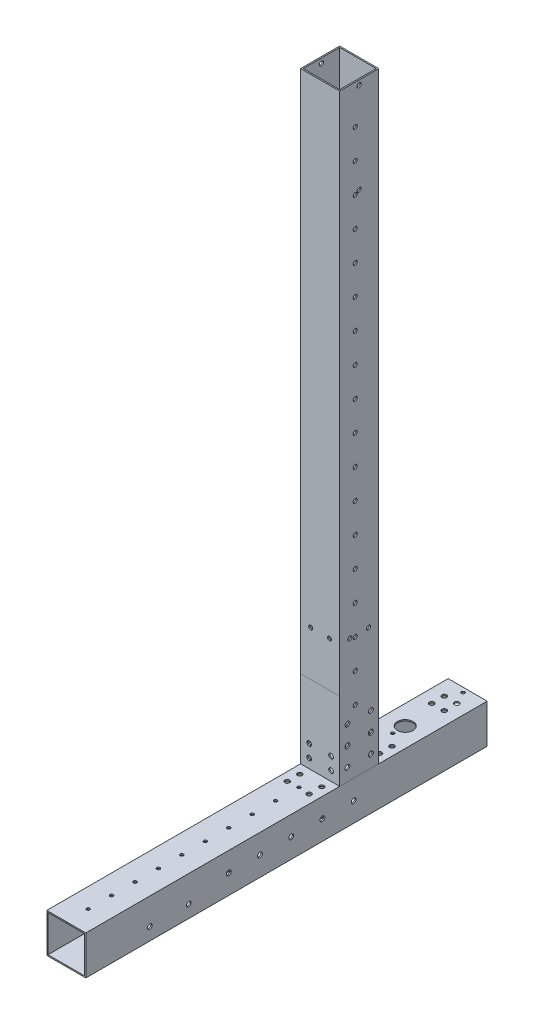
from build123d import *

# Parameters (mm, degrees)
F_20X20X1_1_DEPTH          = 398
F_20X20X1_1_DEPTH_BACK     = 1
SKETCH_11_W                = 25
SKETCH_11_H                = 25
SKETCH_11_W_2              = 23.4
SKETCH_11_H_2              = 23.4
SKETCH_11_ON_SEGMENT_2_W   = 25
SKETCH_11_ON_SEGMENT_2_H   = 25
SKETCH_11_ON_SEGMENT_2_W_2 = 23.4
SKETCH_11_ON_SEGMENT_2_H_2 = 23.4
F_20X20X1_1_2_DEPTH        = 257
SKETCH_18_R                = 1.05
SKETCH_18_R_2              = 1.55
SKETCH_18_R_3              = 5
CUT_EXTRUDE_7_DEPTH        = 447.420765646
SKETCH_20_R                = 1.5
CUT_EXTRUDE_9_DEPTH        = 436.492824281
SKETCH_25_W                = 25
SKETCH_25_H                = 50
CUT_EXTRUDE_13_DEPTH       = 0.01
SKETCH_26_R                = 1.3
CUT_EXTRUDE_14_DEPTH       = 436.492824281
SKETCH_27_R                = 1.3
CUT_EXTRUDE_15_DEPTH       = 441.132366454
SKETCH_28_R                = 1.55
SKETCH_28_R_2              = 1.3
SKETCH_28_R_3              = 1.35
CUT_EXTRUDE_16_DEPTH       = 436.492824281
SKETCH_29_R                = 1.5
CUT_EXTRUDE_17_DEPTH       = 424.546337489
SKETCH_30_R                = 1.5
CUT_EXTRUDE_18_DEPTH       = 431.07731863


with BuildPart() as part:
    # 草图11 → 方形管 20X20X1(1) (new, two sides: drawn at the far end of the back side and taken through both)
    with BuildSketch(Plane(origin=(0, 0, 0), x_dir=(1, 0, 0), z_dir=(0, 1, 0)).offset(-F_20X20X1_1_DEPTH_BACK)):
        Rectangle(SKETCH_11_W, SKETCH_11_H)
        Rectangle(SKETCH_11_W_2, SKETCH_11_H_2, mode=Mode.SUBTRACT)
    extrude(amount=F_20X20X1_1_DEPTH + F_20X20X1_1_DEPTH_BACK)

    # 方形管 20X20X1(1) end butt 1
    split(bisect_by=Plane(origin=(0, 12.5, 0), x_dir=(-1, 0, 0), z_dir=(0, 1, 0)), keep=Keep.TOP)

    # 草图25 → 切除-拉伸13 (cut)
    with BuildSketch(Plane.XY.offset(12.5)):
        with Locations((0, 37.5)):
            Rectangle(SKETCH_25_W, SKETCH_25_H)
    extrude(amount=-CUT_EXTRUDE_13_DEPTH, mode=Mode.SUBTRACT)

    # 草图26 → 切除-拉伸14 (cut, through all)
    with BuildSketch(Plane.ZY.offset(12.5)):
        with Locations((-6, 91.25)):
            Circle(SKETCH_26_R)
        with Locations((6, 91.25)):
            Circle(SKETCH_26_R)
    extrude(amount=-CUT_EXTRUDE_14_DEPTH, mode=Mode.SUBTRACT)

    # 草图27 → 切除-拉伸15 (cut, through all)
    with BuildSketch(Plane(origin=(0, 0, -12.5), x_dir=(-1, 0, 0), z_dir=(0, 0, -1))):
        with Locations((-6, 91.25)):
            Circle(SKETCH_27_R)
        with Locations((6, 91.25)):
            Circle(SKETCH_27_R)
    extrude(amount=-CUT_EXTRUDE_15_DEPTH, mode=Mode.SUBTRACT)


with BuildPart() as body_2:
    # 草图11 on segment 2 (carried to segment 2) → 20X20X1_1 2 (new body)
    with BuildSketch(Plane.XY.offset(-82)):
        Rectangle(SKETCH_11_ON_SEGMENT_2_W, SKETCH_11_ON_SEGMENT_2_H)
        Rectangle(SKETCH_11_ON_SEGMENT_2_W_2, SKETCH_11_ON_SEGMENT_2_H_2, mode=Mode.SUBTRACT)
    extrude(amount=F_20X20X1_1_2_DEPTH)

    # 草图18 → 切除-拉伸7 (cut, through all)
    with BuildSketch(Plane.XZ.offset(12.5)):
        with Locations((0, 236)):
            Circle(SKETCH_18_R)
        with Locations((0, 221)):
            Circle(SKETCH_18_R)
        with Locations((0, 206)):
            Circle(SKETCH_18_R)
        with Locations((0, 191)):
            Circle(SKETCH_18_R)
        with Locations((0, 176)):
            Circle(SKETCH_18_R)
        with Locations(Location((0, 161, 0), (0, 0, 270))):
            Circle(SKETCH_18_R)
        with Locations(Location((0, 146, 0), (0, 0, 270))):
            Circle(SKETCH_18_R)
        with Locations(Location((0, 131, 0), (0, 0, 270))):
            Circle(SKETCH_18_R)
        with Locations(Location((0, 116, 0), (0, 0, 270))):
            Circle(SKETCH_18_R)
        with Locations(Location((0, 101, 0), (0, 0, 270))):
            Circle(SKETCH_18_R)
        with Locations(Location((0, 86, 0), (0, 0, 270))):
            Circle(SKETCH_18_R)
        with Locations(Location((0, 71, 0), (0, 0, 270))):
            Circle(SKETCH_18_R)
        with Locations(Location((0, 56, 0), (0, 0, 270))):
            Circle(SKETCH_18_R)
        with Locations(Location((0, 41, 0), (0, 0, 270))):
            Circle(SKETCH_18_R)
        with Locations(Location((0, 26, 0), (0, 0, 270))):
            Circle(SKETCH_18_R)
        with Locations(Location((0, 11, 0), (0, 0, 270))):
            Circle(SKETCH_18_R)
        with Locations(Location((0, -4, 0), (0, 0, 270))):
            Circle(SKETCH_18_R)
        with Locations(Location((0, -19, 0), (0, 0, 270))):
            Circle(SKETCH_18_R)
        with Locations(Location((0, -34, 0), (0, 0, 270))):
            Circle(SKETCH_18_R)
        with Locations(Location((0, -79, 0), (0, 0, 270))):
            Circle(SKETCH_18_R)
        with Locations((0, -94)):
            Circle(SKETCH_18_R)
        with Locations((0, -109)):
            Circle(SKETCH_18_R)
        with Locations((0, -124)):
            Circle(SKETCH_18_R)
        with Locations((0, -139)):
            Circle(SKETCH_18_R)
        with Locations((0, -154)):
            Circle(SKETCH_18_R)
        with Locations((0, -169)):
            Circle(SKETCH_18_R)
        with Locations(Location((4, -71, 0), (0, 0, 270))):
            Circle(SKETCH_18_R_2)
        with Locations(Location((4, -63, 0), (0, 0, 270))):
            Circle(SKETCH_18_R_2)
        with Locations(Location((-4, -63, 0), (0, 0, 90))):
            Circle(SKETCH_18_R_2)
        with Locations(Location((-4, -71, 0), (0, 0, 90))):
            Circle(SKETCH_18_R_2)
        with Locations(Location((0, -42, 0), (0, 0, 270))):
            Circle(SKETCH_18_R_3)
        with Locations((0, 251)):
            Circle(SKETCH_18_R)
        with Locations((0, 266)):
            Circle(SKETCH_18_R)
        with Locations((0, 281)):
            Circle(SKETCH_18_R)
        with Locations((0, 296)):
            Circle(SKETCH_18_R)
    extrude(amount=-CUT_EXTRUDE_7_DEPTH, mode=Mode.SUBTRACT)

    # 草图20 → 切除-拉伸9 (cut, through all)
    with BuildSketch(Plane.ZY.offset(12.5)):
        with Locations(Location((109, -4.5, 0), (0, 0, 270))):
            Circle(SKETCH_20_R)
        with Locations(Location((134, -4.5, 0), (0, 0, 270))):
            Circle(SKETCH_20_R)
    extrude(amount=-CUT_EXTRUDE_9_DEPTH, mode=Mode.SUBTRACT)


with BuildPart() as cut_extrude_16_tool:
    # 草图28 → 切除-拉伸16 (new, through all)
    with BuildSketch(Plane.ZY.offset(12.5)):
        with Locations((7.5, 20.5)):
            Circle(SKETCH_28_R)
        with Locations((-7.5, 20.5)):
            Circle(SKETCH_28_R)
        with Locations((-7.5, 32.5)):
            Circle(SKETCH_28_R)
        with Locations((7.5, 32.5)):
            Circle(SKETCH_28_R)
        with Locations((7.5, 44.5)):
            Circle(SKETCH_28_R)
        with Locations((-7.5, 44.5)):
            Circle(SKETCH_28_R)
        with Locations((2.5, 109.26)):
            Circle(SKETCH_28_R_2)
        with Locations((83.5, 0)):
            Circle(SKETCH_28_R)
        with Locations((63.5, 0)):
            Circle(SKETCH_28_R)
        with Locations((43.5, 0)):
            Circle(SKETCH_28_R)
        with Locations((23.5, 0)):
            Circle(SKETCH_28_R)
        with Locations((3.5, 0)):
            Circle(SKETCH_28_R)
        with Locations((2.5, 90.41)):
            Circle(SKETCH_28_R_2)
        with Locations((2.5, 71.56)):
            Circle(SKETCH_28_R_2)
        with Locations((2.5, 52.71)):
            Circle(SKETCH_28_R_2)
        with Locations((0, 337)):
            Circle(SKETCH_28_R_2)
        with Locations((2.5, 373.16)):
            Circle(SKETCH_28_R_2)
        with Locations((0, 395)):
            Circle(SKETCH_28_R_3)
        with Locations((2.5, 354.31)):
            Circle(SKETCH_28_R_2)
        with Locations((2.5, 335.46)):
            Circle(SKETCH_28_R_2)
        with Locations((2.5, 316.61)):
            Circle(SKETCH_28_R_2)
        with Locations((2.5, 297.76)):
            Circle(SKETCH_28_R_2)
        with Locations((2.5, 278.91)):
            Circle(SKETCH_28_R_2)
        with Locations((2.5, 260.06)):
            Circle(SKETCH_28_R_2)
        with Locations((2.5, 241.21)):
            Circle(SKETCH_28_R_2)
        with Locations((2.5, 222.36)):
            Circle(SKETCH_28_R_2)
        with Locations((2.5, 203.51)):
            Circle(SKETCH_28_R_2)
        with Locations((2.5, 184.66)):
            Circle(SKETCH_28_R_2)
        with Locations((2.5, 165.81)):
            Circle(SKETCH_28_R_2)
        with Locations((2.5, 146.96)):
            Circle(SKETCH_28_R_2)
        with Locations((2.5, 128.11)):
            Circle(SKETCH_28_R_2)
    extrude(amount=-CUT_EXTRUDE_16_DEPTH)


with BuildPart() as part_1:
    add(part.part)

    # 切除-拉伸16: cut by cut_extrude_16_tool
    add(cut_extrude_16_tool.part, mode=Mode.SUBTRACT)

    # 草图30 → 切除-拉伸18 (cut, through all)
    with BuildSketch(Plane.XY.offset(12.5)):
        with Locations(Location((7, 26.5, 0), (0, 0, 180))):
            Circle(SKETCH_30_R)
        with Locations(Location((7, 18.5, 0), (0, 0, 180))):
            Circle(SKETCH_30_R)
        with Locations(Location((-7, 18.5, 0), (0, 0, 180))):
            Circle(SKETCH_30_R)
        with Locations(Location((-7, 26.5, 0), (0, 0, 180))):
            Circle(SKETCH_30_R)
    extrude(amount=-CUT_EXTRUDE_18_DEPTH, mode=Mode.SUBTRACT)


with BuildPart() as body_2_1:
    add(body_2.part)

    # 切除-拉伸16: cut by cut_extrude_16_tool
    add(cut_extrude_16_tool.part, mode=Mode.SUBTRACT)

    # 草图29 → 切除-拉伸17 (cut, through all)
    with BuildSketch(Plane(origin=(0, 12.5, 0), x_dir=(1, 0, 0), z_dir=(0, 1, 0))):
        with Locations(Location((-7, 18.5, 0), (0, 0, 270))):
            Circle(SKETCH_29_R)
        with Locations(Location((7, 18.5, 0), (0, 0, 270))):
            Circle(SKETCH_29_R)
        with Locations(Location((-7, 26.5, 0), (0, 0, 270))):
            Circle(SKETCH_29_R)
        with Locations(Location((7, 26.5, 0), (0, 0, 270))):
            Circle(SKETCH_29_R)
        with Locations(Location((7, -18.5, 0), (0, 0, 270))):
            Circle(SKETCH_29_R)
        with Locations(Location((7, -26.5, 0), (0, 0, 270))):
            Circle(SKETCH_29_R)
        with Locations(Location((-7, -26.5, 0), (0, 0, 270))):
            Circle(SKETCH_29_R)
        with Locations(Location((-7, -18.5, 0), (0, 0, 270))):
            Circle(SKETCH_29_R)
    extrude(amount=-CUT_EXTRUDE_17_DEPTH, mode=Mode.SUBTRACT)


solid = Compound([part_1.part, body_2_1.part])
